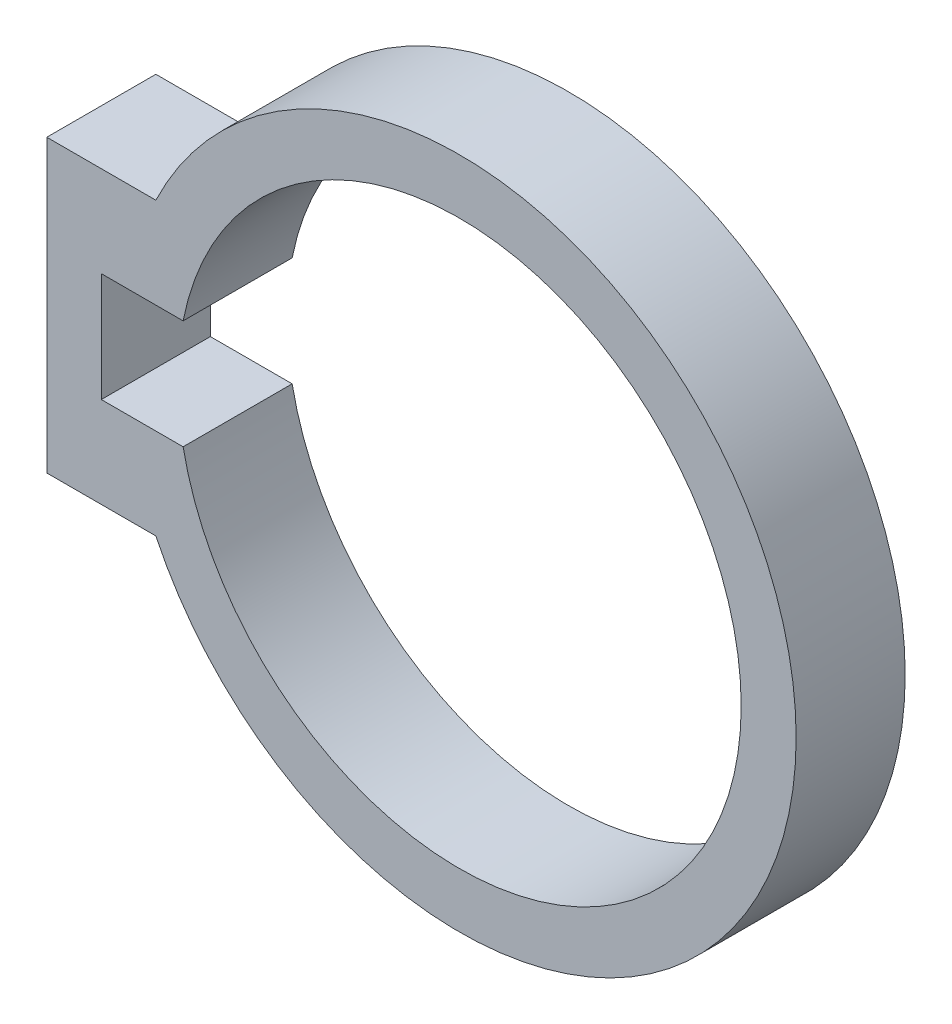
from build123d import *

# Parameters (mm, degrees)
BOSS_EXTRU_1_DEPTH = 6


with BuildPart() as part:
    # Esquisse1 → Boss.-Extru.1 (new body)
    with BuildSketch(Plane.XY):
        with BuildLine():
            Line((0, 0), (6, 0))
            ThreePointArc((6, 0), (41.230424323, -8), (6, -16))
            Line((6, -16), (0, -16))
            Line((0, -16), (0, 0))
        make_face()
        with BuildLine():
            Line((3, -5), (7.5, -5))
            ThreePointArc((7.5, -5), (38.206906326, -8), (7.5, -11))
            Line((7.5, -11), (3, -11))
            Line((3, -11), (3, -5))
        make_face(mode=Mode.SUBTRACT)
    extrude(amount=BOSS_EXTRU_1_DEPTH)


solid = part.part
